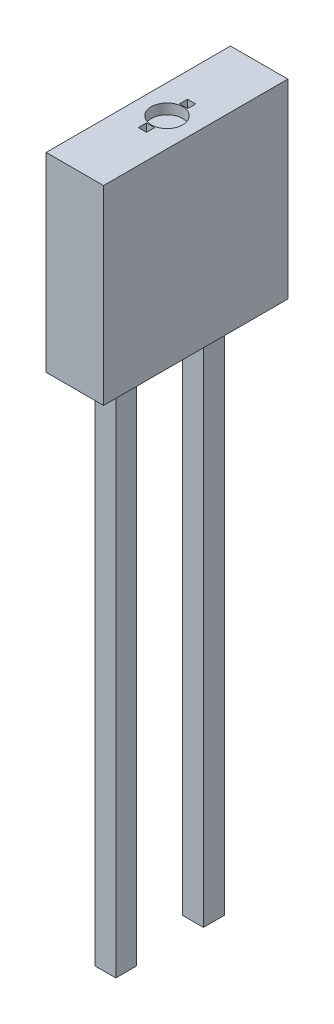
from build123d import *

# Parameters (mm, degrees)
CROQUIS1_W              = 1.4
CROQUIS1_H              = 4.5
SALIENTE_EXTRUIR1_DEPTH = 4.65
CROQUIS3_R              = 0.383471958
CORTAR_EXTRUIR1_DEPTH   = 0.25
CROQUIS4_W              = 0.2
CROQUIS4_H              = 0.2
CORTAR_EXTRUIR5_DEPTH   = 0.25
CROQUIS5_W              = 0.51
CROQUIS5_H              = 0.51
SALIENTE_EXTRUIR2_DEPTH = 12.7


with BuildPart() as part:
    # Croquis1 → Saliente-Extruir1 (new body)
    with BuildSketch(Plane(origin=(0, 0, 0), x_dir=(1, 0, 0), z_dir=(0, 1, 0))):
        with Locations((-0.7, -2.25)):
            Rectangle(CROQUIS1_W, CROQUIS1_H)
    extrude(amount=SALIENTE_EXTRUIR1_DEPTH)

    # Croquis3 → Cortar-Extruir1 (cut)
    with BuildSketch(Plane(origin=(0, 4.65, 0), x_dir=(1, 0, 0), z_dir=(0, 1, 0))):
        with Locations(Location((-0.7, -2.25, 0), (0, 0, 270))):
            Circle(CROQUIS3_R)
    extrude(amount=-CORTAR_EXTRUIR1_DEPTH, mode=Mode.SUBTRACT)

    # Croquis4 → Cortar-Extruir5 (cut)
    with BuildSketch(Plane(origin=(0, 4.65, 0), x_dir=(1, 0, 0), z_dir=(0, 1, 0))):
        with Locations((-0.7, -1.75)):
            Rectangle(CROQUIS4_W, CROQUIS4_H)
        with Locations((-0.7, -2.75)):
            Rectangle(CROQUIS4_W, CROQUIS4_H)
    extrude(amount=-CORTAR_EXTRUIR5_DEPTH, mode=Mode.SUBTRACT)

    # Croquis5 → Saliente-Extruir2 (add)
    with BuildSketch(Plane.XZ):
        with Locations((-0.7, 3.5)):
            Rectangle(CROQUIS5_W, CROQUIS5_H)
        with Locations((-0.7, 1.361338898)):
            Rectangle(CROQUIS5_W, CROQUIS5_H)
    extrude(amount=SALIENTE_EXTRUIR2_DEPTH)


solid = part.part
